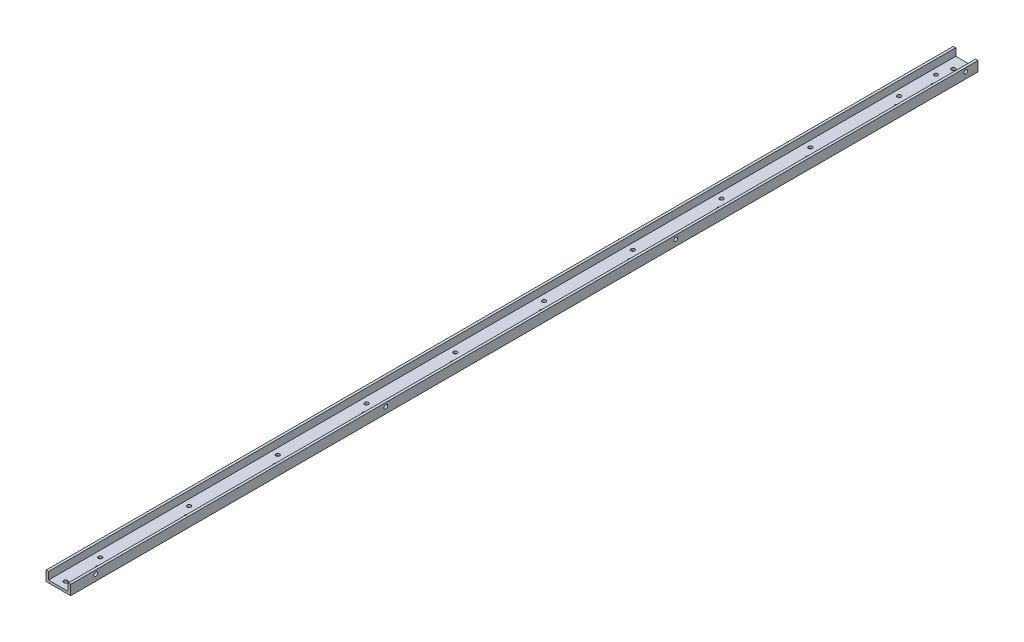
from build123d import *

# Parameters (mm, degrees)
BOSS_EXTRUDE1_DEPTH = 1168.4
CUT_EXTRUDE1_REACH  = 1170.87
SKETCH3_R           = 2.413
CUT_EXTRUDE2_REACH  = 1170.87
SKETCH4_R           = 2.413
LPATTERN1_COUNT     = 10
LPATTERN1_PITCH     = 114.3
CUT_EXTRUDE3_REACH  = 1170.9
SKETCH5_R           = 2.413
CUT_EXTRUDE4_REACH  = 1170.9
SKETCH6_R           = 2.413
CUT_EXTRUDE5_REACH  = 1170.87
SKETCH7_R           = 2.413


with BuildPart() as part:
    # Sketch1 → Boss-Extrude1 (new body)
    with BuildSketch(Plane.XY):
        Polygon((3.175, 3.175), (3.175, 12.7), (0, 12.7), (0, 0), (31.75, 0), (31.75, 12.7), (28.575, 12.7), (28.575, 3.175), align=None)
    extrude(amount=BOSS_EXTRUDE1_DEPTH)

    # Sketch3 → Cut-Extrude1 (cut, up to next)
    with BuildSketch(Plane(origin=(0, 3.175, 0), x_dir=(1, 0, 0), z_dir=(0, 1, 0)), mode=Mode.PRIVATE) as cut_extrude1_sk1:
        with Locations(Location((11.1125, -1109.6625, 0), (0, 0, 270))):
            Circle(SKETCH3_R)
    cut_extrude1_tool1 = extrude(cut_extrude1_sk1.sketch, amount=-CUT_EXTRUDE1_REACH, mode=Mode.PRIVATE) & part.part
    # Sketch3 → Cut-Extrude1 (cut, up to next)
    with BuildSketch(Plane(origin=(0, 3.175, 0), x_dir=(1, 0, 0), z_dir=(0, 1, 0)), mode=Mode.PRIVATE) as cut_extrude1_sk2:
        with Locations(Location((20.6375, -1122.3625, 0), (0, 0, 270))):
            Circle(SKETCH3_R)
    cut_extrude1_tool2 = extrude(cut_extrude1_sk2.sketch, amount=-CUT_EXTRUDE1_REACH, mode=Mode.PRIVATE) & part.part
    cut_extrude1_1 = cut_extrude1_tool1.solids().sort_by_distance((11.1125, 3.175, 1109.6625))[0]
    add(cut_extrude1_1, mode=Mode.SUBTRACT)
    cut_extrude1_2 = cut_extrude1_tool2.solids().sort_by_distance((20.6375, 3.175, 1122.3625))[0]
    add(cut_extrude1_2, mode=Mode.SUBTRACT)
    cut_extrude1 = cut_extrude1_1 + cut_extrude1_2  # Cut-Extrude1 as one shape, for the pattern or mirror that repeats it

    # Sketch4 → Cut-Extrude2 (cut, up to next)
    with BuildSketch(Plane(origin=(0, 3.175, 0), x_dir=(1, 0, 0), z_dir=(0, 1, 0)), mode=Mode.PRIVATE) as cut_extrude2_sk1:
        with Locations(Location((15.875, -1158.875, 0), (0, 0, 270))):
            Circle(SKETCH4_R)
    cut_extrude2_tool1 = extrude(cut_extrude2_sk1.sketch, amount=-CUT_EXTRUDE2_REACH, mode=Mode.PRIVATE) & part.part
    add(cut_extrude2_tool1.solids().sort_by_distance((15.875, 3.175, 1158.875))[0], mode=Mode.SUBTRACT)

    # LPattern1: Cut-Extrude1 ×10
    with Locations(*[(0, 0, -i * LPATTERN1_PITCH) for i in range(1, LPATTERN1_COUNT)]):
        add(cut_extrude1, mode=Mode.SUBTRACT)

    # Sketch5 → Cut-Extrude3 (cut, up to next)
    with BuildSketch(Plane(origin=(31.75, 0, 0), x_dir=(0, 0, -1), z_dir=(1, 0, 0)), mode=Mode.PRIVATE) as cut_extrude3_sk1:
        with Locations((-389.255, 7.9375)):
            Circle(SKETCH5_R)
    cut_extrude3_tool1 = extrude(cut_extrude3_sk1.sketch, amount=-CUT_EXTRUDE3_REACH, mode=Mode.PRIVATE) & part.part
    # Sketch5 → Cut-Extrude3 (cut, up to next)
    with BuildSketch(Plane(origin=(31.75, 0, 0), x_dir=(0, 0, -1), z_dir=(1, 0, 0)), mode=Mode.PRIVATE) as cut_extrude3_sk2:
        with Locations((-15.875, 7.9375)):
            Circle(SKETCH5_R)
    cut_extrude3_tool2 = extrude(cut_extrude3_sk2.sketch, amount=-CUT_EXTRUDE3_REACH, mode=Mode.PRIVATE) & part.part
    # Sketch5 → Cut-Extrude3 (cut, up to next)
    with BuildSketch(Plane(origin=(31.75, 0, 0), x_dir=(0, 0, -1), z_dir=(1, 0, 0)), mode=Mode.PRIVATE) as cut_extrude3_sk3:
        with Locations((-762.635, 7.9375)):
            Circle(SKETCH5_R)
    cut_extrude3_tool3 = extrude(cut_extrude3_sk3.sketch, amount=-CUT_EXTRUDE3_REACH, mode=Mode.PRIVATE) & part.part
    # Sketch5 → Cut-Extrude3 (cut, up to next)
    with BuildSketch(Plane(origin=(31.75, 0, 0), x_dir=(0, 0, -1), z_dir=(1, 0, 0)), mode=Mode.PRIVATE) as cut_extrude3_sk4:
        with Locations((-1136.015, 7.9375)):
            Circle(SKETCH5_R)
    cut_extrude3_tool4 = extrude(cut_extrude3_sk4.sketch, amount=-CUT_EXTRUDE3_REACH, mode=Mode.PRIVATE) & part.part
    add(cut_extrude3_tool1.solids().sort_by_distance((31.75, 7.9375, 389.255))[0], mode=Mode.SUBTRACT)
    add(cut_extrude3_tool2.solids().sort_by_distance((31.75, 7.9375, 15.875))[0], mode=Mode.SUBTRACT)
    add(cut_extrude3_tool3.solids().sort_by_distance((31.75, 7.9375, 762.635))[0], mode=Mode.SUBTRACT)
    add(cut_extrude3_tool4.solids().sort_by_distance((31.75, 7.9375, 1136.015))[0], mode=Mode.SUBTRACT)

    # Sketch6 → Cut-Extrude4 (cut, up to next)
    with BuildSketch(Plane.XZ, mode=Mode.PRIVATE) as cut_extrude4_sk1:
        with Locations(Location((11.1125, 33.3375, 0), (0, 0, 270))):
            Circle(SKETCH6_R)
    cut_extrude4_tool1 = extrude(cut_extrude4_sk1.sketch, amount=-CUT_EXTRUDE4_REACH, mode=Mode.PRIVATE) & part.part
    # Sketch6 → Cut-Extrude4 (cut, up to next)
    with BuildSketch(Plane.XZ, mode=Mode.PRIVATE) as cut_extrude4_sk2:
        with Locations(Location((20.6375, 46.0375, 0), (0, 0, 270))):
            Circle(SKETCH6_R)
    cut_extrude4_tool2 = extrude(cut_extrude4_sk2.sketch, amount=-CUT_EXTRUDE4_REACH, mode=Mode.PRIVATE) & part.part
    add(cut_extrude4_tool1.solids().sort_by_distance((11.1125, 0, 33.3375))[0], mode=Mode.SUBTRACT)
    add(cut_extrude4_tool2.solids().sort_by_distance((20.6375, 0, 46.0375))[0], mode=Mode.SUBTRACT)

    # Sketch7 → Cut-Extrude5 (cut, up to next)
    with BuildSketch(Plane(origin=(0, 3.175, 0), x_dir=(1, 0, 0), z_dir=(0, 1, 0)), mode=Mode.PRIVATE) as cut_extrude5_sk1:
        with Locations(Location((15.875, -15.875, 0), (0, 0, 270))):
            Circle(SKETCH7_R)
    cut_extrude5_tool1 = extrude(cut_extrude5_sk1.sketch, amount=-CUT_EXTRUDE5_REACH, mode=Mode.PRIVATE) & part.part
    add(cut_extrude5_tool1.solids().sort_by_distance((15.875, 3.175, 15.875))[0], mode=Mode.SUBTRACT)


solid = part.part
